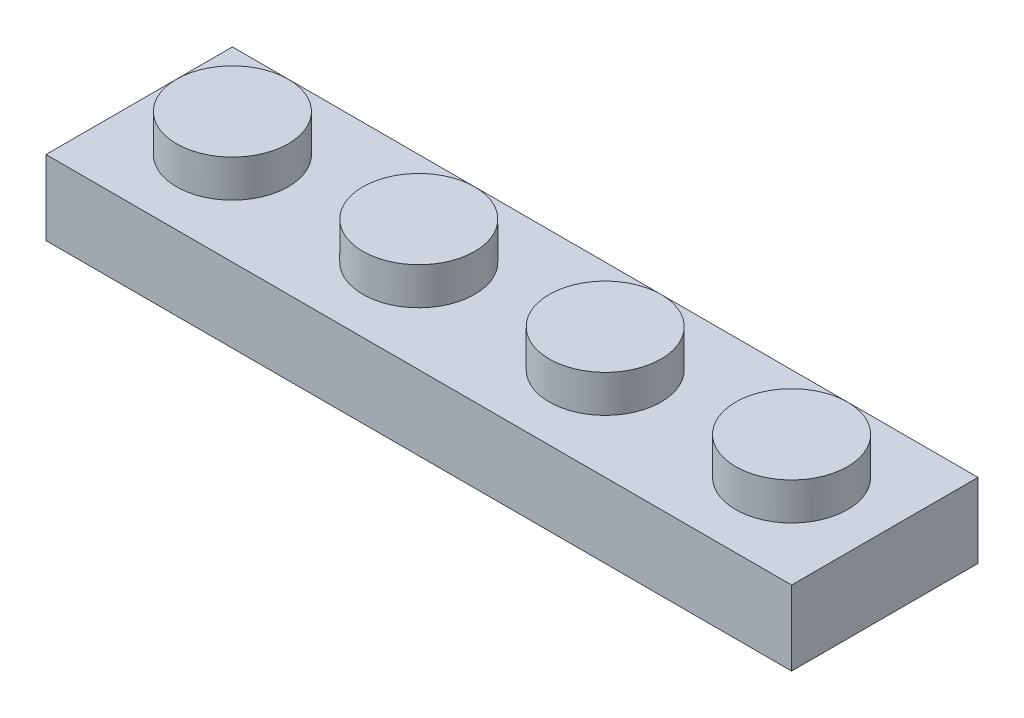
from build123d import *

# Parameters (mm, degrees)
SKETCH1_W           = 32
SKETCH1_H           = 8
BOSS_EXTRUDE1_DEPTH = 3.2
SKETCH2_R           = 2.4
BOSS_EXTRUDE2_DEPTH = 1.6
LPATTERN1_COUNT     = 4
LPATTERN1_PITCH     = 8
SHELL1_T            = -1.6


with BuildPart() as part:
    # Sketch1 → Boss-Extrude1 (new body)
    with BuildSketch(Plane(origin=(0, 0, 0), x_dir=(1, 0, 0), z_dir=(0, 1, 0))):
        with Locations((16, 4)):
            Rectangle(SKETCH1_W, SKETCH1_H)
    extrude(amount=BOSS_EXTRUDE1_DEPTH)

    # Sketch2 → Boss-Extrude2 (add)
    with BuildSketch(Plane(origin=(0, 3.2, 0), x_dir=(1, 0, 0), z_dir=(0, 1, 0))):
        with Locations(Location((28, 4, 0), (0, 0, 90))):
            Circle(SKETCH2_R)
    boss_extrude2 = extrude(amount=BOSS_EXTRUDE2_DEPTH)

    # LPattern1: Boss-Extrude2 ×4
    with Locations(*[(-i * LPATTERN1_PITCH, 0, 0) for i in range(1, LPATTERN1_COUNT)]):
        add(boss_extrude2)

    # Shell1
    shell1_openings = [part.faces().sort_by_distance(p)[0] for p in [
        (16, 0, -4),
    ]]
    offset(amount=SHELL1_T, openings=shell1_openings, kind=Kind.INTERSECTION)


solid = part.part
